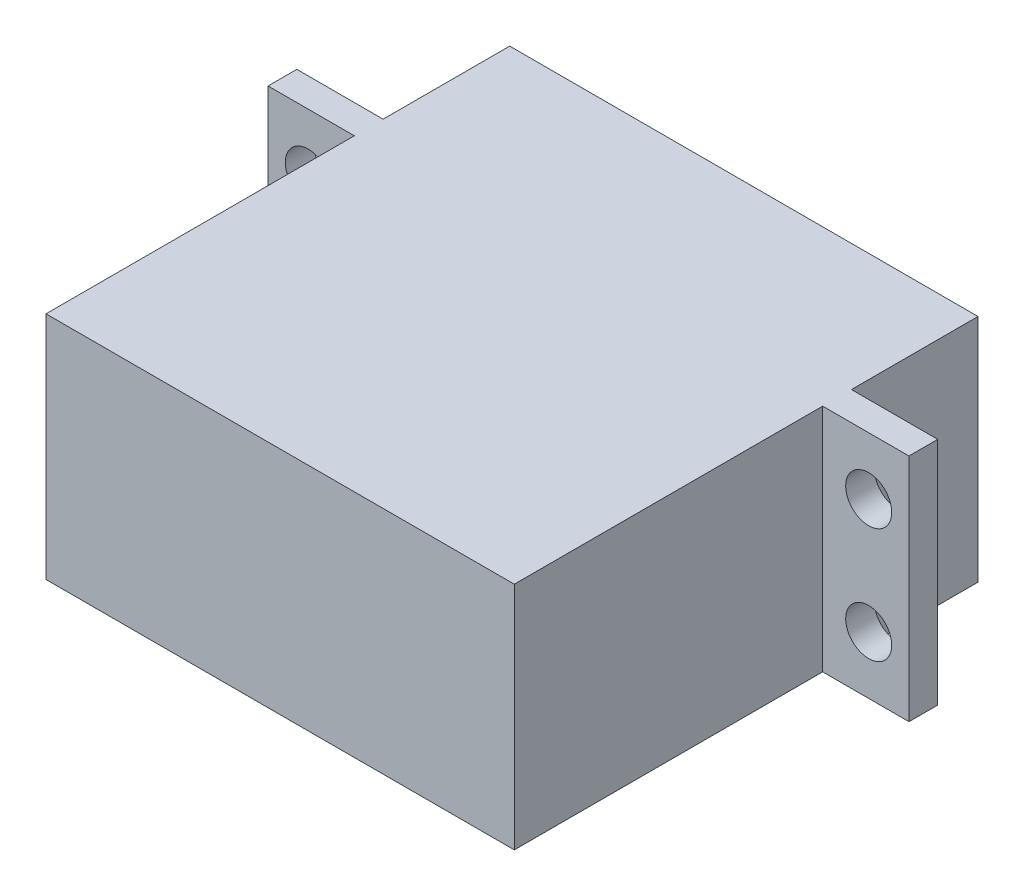
from build123d import *

# Parameters (mm, degrees)
SCHIZZO1_W                   = 40.7
SCHIZZO1_H                   = 20
ESTRUSIONE_ESTRUSIONE1_DEPTH = 40.3
SCHIZZO2_W                   = 2.5
SCHIZZO2_H                   = 20
ESTRUSIONE_ESTRUSIONE2_DEPTH = 7.5
RIPETIZIONE_A_L1_COUNT       = 2
RIPETIZIONE_A_L1_PITCH       = 48.2
SCHIZZO3_R                   = 3
ESTRUSIONE_ESTRUSIONE3_DEPTH = 4
SCHIZZO4_R                   = 2
TAGLIO_ESTRUSIONE1_DEPTH     = 10


with BuildPart() as part:
    # Schizzo1 → Estrusione-Estrusione1 (new body)
    with BuildSketch(Plane.XY):
        Rectangle(SCHIZZO1_W, SCHIZZO1_H)
    extrude(amount=ESTRUSIONE_ESTRUSIONE1_DEPTH)

    # Schizzo2 → Estrusione-Estrusione2 (add)
    with BuildSketch(Plane(origin=(20.35, 0, 0), x_dir=(0, 0, -1), z_dir=(1, 0, 0))):
        with Locations((-12.25, 0)):
            Rectangle(SCHIZZO2_W, SCHIZZO2_H)
    estrusione_estrusione2 = extrude(amount=ESTRUSIONE_ESTRUSIONE2_DEPTH)

    # Ripetizione a L1: Estrusione-Estrusione2 ×2
    with Locations(*[(-i * RIPETIZIONE_A_L1_PITCH, 0, 0) for i in range(1, RIPETIZIONE_A_L1_COUNT)]):
        add(estrusione_estrusione2)

    # Schizzo3 → Estrusione-Estrusione3 (add)
    with BuildSketch(Plane(origin=(0, 0, 0), x_dir=(-1, 0, 0), z_dir=(0, 0, -1))):
        with Locations((-10.35, 0)):
            Circle(SCHIZZO3_R)
    extrude(amount=ESTRUSIONE_ESTRUSIONE3_DEPTH)

    # Schizzo4 → Taglio-Estrusione1 (cut)
    with BuildSketch(Plane(origin=(0, 0, 11), x_dir=(-1, 0, 0), z_dir=(0, 0, -1))):
        with Locations(Location((-24.35, 5, 0), (0, 0, 90))):
            Circle(SCHIZZO4_R)
        with Locations(Location((-24.35, -5, 0), (0, 0, 90))):
            Circle(SCHIZZO4_R)
        with Locations(Location((24.35, 5, 0), (0, 0, 90))):
            Circle(SCHIZZO4_R)
        with Locations(Location((24.35, -5, 0), (0, 0, 90))):
            Circle(SCHIZZO4_R)
    extrude(amount=-TAGLIO_ESTRUSIONE1_DEPTH, mode=Mode.SUBTRACT)


solid = part.part
